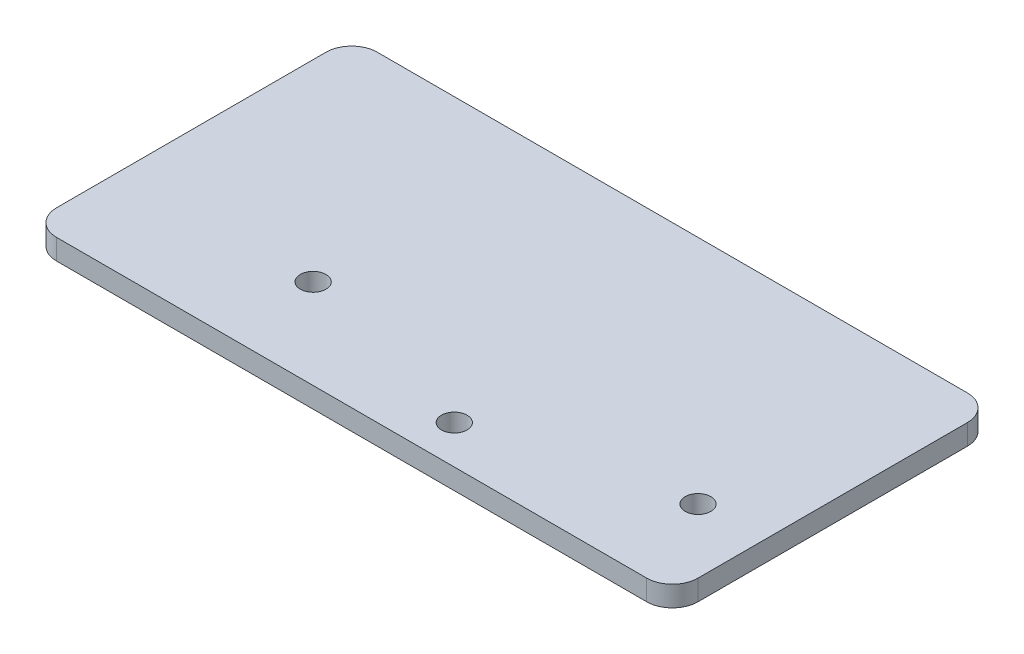
from build123d import *

# Parameters (mm, degrees)
SKETCH_1_W      = 50
SKETCH_1_H      = 25
SKETCH_1_R      = 1
EXTRUDE_1_DEPTH = 1.6
FILLET_1_R      = 2


with BuildPart() as part:
    # 草图1 → 凸台-拉伸1 (new body)
    with BuildSketch(Plane(origin=(0, 0, 0), x_dir=(1, 0, 0), z_dir=(0, 1, 0))):
        Rectangle(SKETCH_1_W, SKETCH_1_H)
        with Locations(Location((-10, -5.5, 0), (0, 0, 270))):
            Circle(SKETCH_1_R, mode=Mode.SUBTRACT)
        with Locations(Location((20, -5.5, 0), (0, 0, 270))):
            Circle(SKETCH_1_R, mode=Mode.SUBTRACT)
        with Locations(Location((5, -9.5, 0), (0, 0, 270))):
            Circle(SKETCH_1_R, mode=Mode.SUBTRACT)
    extrude(amount=EXTRUDE_1_DEPTH)

    # 圆角1
    fillet_1_edges = [part.edges().sort_by_distance(p)[0] for p in [
        (25, 0.8, 12.5),
        (-25, 0.8, 12.5),
        (-25, 0.8, -12.5),
        (25, 0.8, -12.5),
    ]]
    fillet(fillet_1_edges, radius=FILLET_1_R)


solid = part.part
